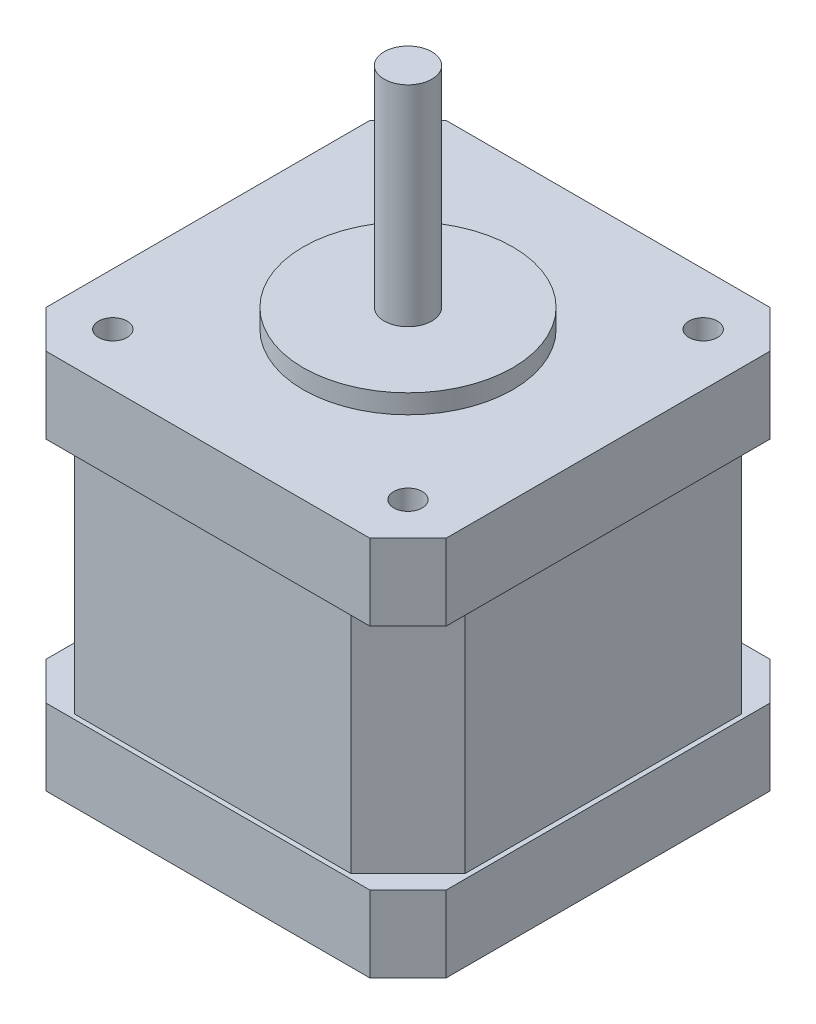
from build123d import *

# Parameters (mm, degrees)
SKETCH1_W           = 42
SKETCH1_H           = 42
BOSS_EXTRUDE1_DEPTH = 8
LPATTERN2_COUNT     = 2
LPATTERN2_PITCH     = 32
BOSS_EXTRUDE4_REACH = 45.658
SKETCH5_W           = 41
SKETCH5_H           = 41
CHAMFER2_SIZE       = 6
CHAMFER1_SIZE       = 4
SKETCH2_R           = 11
BOSS_EXTRUDE2_DEPTH = 2
SKETCH3_R           = 2.5
BOSS_EXTRUDE3_DEPTH = 22
SKETCH6_R           = 1.5
CUT_EXTRUDE1_DEPTH  = 7


with BuildPart() as part:
    # Sketch1 → Boss-Extrude1 (new body)
    with BuildSketch(Plane(origin=(0, 0, 0), x_dir=(1, 0, 0), z_dir=(0, 1, 0))):
        Rectangle(SKETCH1_W, SKETCH1_H)
    extrude(amount=BOSS_EXTRUDE1_DEPTH)


with BuildPart() as lpattern2_1:
    # LPattern2: pattern copy
    add(part.part.moved(Location(Vector(0, -1, 0) * (1 * LPATTERN2_PITCH))))

    # Sketch5 → Boss-Extrude4 (add, up to next)
    with BuildSketch(Plane.XZ, mode=Mode.PRIVATE) as boss_extrude4_sk1:
        Rectangle(SKETCH5_W, SKETCH5_H)
    boss_extrude4_tool1 = extrude(boss_extrude4_sk1.sketch, amount=BOSS_EXTRUDE4_REACH, mode=Mode.PRIVATE) - lpattern2_1.part

    add(part.part)  # Boss-Extrude4 merges part
    add(boss_extrude4_tool1.solids().sort_by_distance((0, 0, 0))[0])

    # Chamfer2
    chamfer2_edges = [lpattern2_1.edges().sort_by_distance(p)[0] for p in [
        (20.5, -12, 20.5),
        (-20.5, -12, 20.5),
        (-20.5, -12, -20.5),
        (20.5, -12, -20.5),
    ]]
    chamfer(chamfer2_edges, length=CHAMFER2_SIZE)

    # Chamfer1
    chamfer1_edges = [lpattern2_1.edges().sort_by_distance(p)[0] for p in [
        (-21, -28, -21),
        (-21, -28, 21),
        (21, -28, 21),
        (21, -28, -21),
        (-21, 4, -21),
        (21, 4, -21),
        (21, 4, 21),
        (-21, 4, 21),
    ]]
    chamfer(chamfer1_edges, length=CHAMFER1_SIZE)

    # Sketch2 → Boss-Extrude2 (add)
    with BuildSketch(Plane(origin=(0, 8, 0), x_dir=(1, 0, 0), z_dir=(0, 1, 0))):
        with Locations(Location((0, 0, 0), (0, 0, 270))):
            Circle(SKETCH2_R)
    extrude(amount=BOSS_EXTRUDE2_DEPTH)

    # Sketch3 → Boss-Extrude3 (add)
    with BuildSketch(Plane(origin=(0, 10, 0), x_dir=(1, 0, 0), z_dir=(0, 1, 0))):
        with Locations(Location((0, 0, 0), (0, 0, 270))):
            Circle(SKETCH3_R)
    extrude(amount=BOSS_EXTRUDE3_DEPTH)

    # Sketch6 → Cut-Extrude1 (cut)
    with BuildSketch(Plane(origin=(0, 8, 0), x_dir=(1, 0, 0), z_dir=(0, 1, 0))):
        with Locations(Location((-15.5, 15.5, 0), (0, 0, 270))):
            Circle(SKETCH6_R)
        with Locations(Location((15.5, 15.5, 0), (0, 0, 270))):
            Circle(SKETCH6_R)
        with Locations(Location((15.5, -15.5, 0), (0, 0, 270))):
            Circle(SKETCH6_R)
        with Locations(Location((-15.5, -15.5, 0), (0, 0, 270))):
            Circle(SKETCH6_R)
    extrude(amount=-CUT_EXTRUDE1_DEPTH, mode=Mode.SUBTRACT)


solid = lpattern2_1.part
